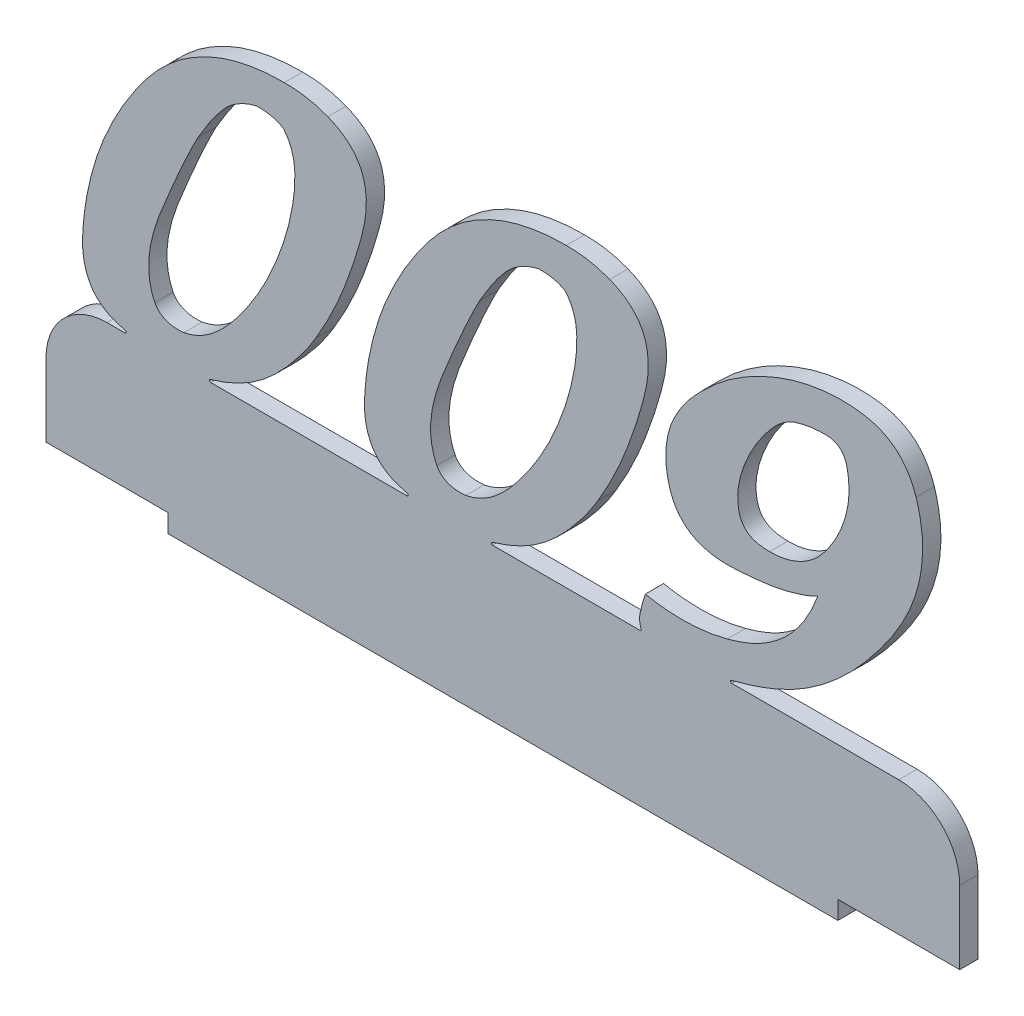
from build123d import *

# Parameters (mm, degrees)
BOSS_EXTRUDE1_DEPTH = 3
FILLET1_R           = 10
FILLET2_R           = 0.2


with BuildPart() as part:
    # Sketch1 → Boss-Extrude1 (new body)
    with BuildSketch(Plane.XY):
        with BuildLine():
            Line((122.108523146, 21.999999993), (150, 21.999999993))
            Line((150, 21.999999993), (150, 0))
            Line((150, 0), (130, 0))
            Line((130, 0), (130, -3))
            Line((130, -3), (20, -3))
            Line((20, -3), (20, 0))
            Line((20, 0), (0, 0))
            Line((0, 0), (0, 21.999999993))
            Line((0, 21.999999993), (14.850734766, 21.999999993))
            add(Edge.make_bspline(
                [(14.850734766, 21.999999993), (13.833222144, 22.185746321), (12.294676232, 22.547490024), (10.31460573, 23.244901476), (9.008220383, 24.094759696), (7.898257387, 25.113820238), (7.06838398, 26.391091086), (6.462901727, 27.862621286), (5.90927732, 30.227463468), (5.978909551, 32.147170043), (6.069251818, 33.461703309)],
                knots=[0.385713636, 0.385713636, 0.385713636, 0.385713636, 0.501387928, 0.562299825, 0.61931963, 0.674487907, 0.729675441, 0.788153341, 0.851799168, 1, 1, 1, 1], degree=3))
            add(Edge.make_bspline(
                [(6.069251818, 33.461703309), (6.236175884, 35.689799717), (6.725368754, 39.015373342), (7.854755227, 43.352177461), (8.917587622, 46.561540842), (10.272211064, 49.694878359), (11.810209289, 52.800707584), (13.617945818, 55.843856526), (15.625030894, 58.810990548), (17.82256933, 61.600339244), (20.296824136, 64.019153046), (22.93908857, 66.106784733), (25.819308824, 67.754175527), (28.85480882, 69.102017217), (33.277216497, 70.324345952), (36.755935353, 70.709060232), (39.122418354, 70.678278759)],
                knots=[0, 0, 0, 0, 0.122246067, 0.183381441, 0.245050885, 0.307031795, 0.37001055, 0.434578783, 0.500534692, 0.565957523, 0.628479512, 0.689453544, 0.749684058, 0.80955899, 0.870724503, 1, 1, 1, 1], degree=3))
            add(Edge.make_bspline(
                [(39.122418354, 70.678278759), (40.382657809, 70.667828905), (42.825497091, 70.524312973), (45.165651014, 69.814457179), (46.256898417, 69.407754912)],
                knots=[0, 0, 0, 0, 0.519885394, 1, 1, 1, 1], degree=3))
            add(Edge.make_bspline(
                [(46.256898417, 69.407754912), (47.52444583, 68.892456699), (49.319498488, 67.899106728), (51.058811155, 65.916194709), (51.968333247, 64.242720588), (52.483615829, 62.337801774), (52.648926803, 60.220756413), (52.455819366, 57.889987868), (51.706419101, 54.550580326), (50.427898754, 50.384152241), (48.126715144, 44.080572726), (45.929798961, 39.654295336), (44.263153303, 36.901890956)],
                knots=[0, 0, 0, 0, 0.111905612, 0.162582178, 0.212592743, 0.265416324, 0.321765959, 0.384451445, 0.45478123, 0.599580751, 0.738515281, 1, 1, 1, 1], degree=3))
            add(Edge.make_bspline(
                [(44.263153303, 36.901890956), (43.171669185, 35.044678672), (41.301371752, 32.474204186), (38.552020372, 29.351221076), (36.383325475, 27.281953243), (34.000893798, 25.474290787), (31.321170001, 23.978496673), (28.47055622, 22.819698003), (26.487014209, 22.240484451), (25.518502149, 21.999999993)],
                knots=[0, 0, 0, 0, 0.257859597, 0.380113614, 0.498337489, 0.61657684, 0.737567111, 0.865047578, 0.984702487, 0.984702487, 0.984702487, 0.984702487], degree=3))
            Line((25.518502149, 21.999999993), (61.136895862, 21.999999993))
            add(Edge.make_bspline(
                [(61.136895862, 21.999999993), (60.11938323, 22.185746322), (58.580837306, 22.547490018), (56.600766794, 23.244901476), (55.294381447, 24.094759696), (54.18441845, 25.113820238), (53.354545044, 26.391091086), (52.749062791, 27.862621286), (52.195438383, 30.227463468), (52.265070614, 32.147170043), (52.355412881, 33.461703309)],
                knots=[0.385713634, 0.385713634, 0.385713634, 0.385713634, 0.501387928, 0.562299825, 0.61931963, 0.674487907, 0.729675441, 0.788153341, 0.851799168, 1, 1, 1, 1], degree=3))
            add(Edge.make_bspline(
                [(52.355412881, 33.461703309), (52.522336947, 35.689799717), (53.011529817, 39.015373342), (54.14091629, 43.352177461), (55.203748685, 46.561540842), (56.558372128, 49.694878359), (58.096370352, 52.800707584), (59.904106881, 55.843856526), (61.911191957, 58.810990548), (64.108730393, 61.600339244), (66.582985199, 64.019153046), (69.225249633, 66.106784733), (72.105469888, 67.754175527), (75.140969883, 69.102017217), (79.56337756, 70.324345952), (83.042096416, 70.709060232), (85.408579417, 70.678278759)],
                knots=[0, 0, 0, 0, 0.122246067, 0.183381441, 0.245050885, 0.307031795, 0.37001055, 0.434578783, 0.500534692, 0.565957523, 0.628479512, 0.689453544, 0.749684058, 0.80955899, 0.870724503, 1, 1, 1, 1], degree=3))
            add(Edge.make_bspline(
                [(85.408579417, 70.678278759), (86.668818873, 70.667828905), (89.111658154, 70.524312973), (91.451812078, 69.814457179), (92.54305948, 69.407754912)],
                knots=[0, 0, 0, 0, 0.519885394, 1, 1, 1, 1], degree=3))
            add(Edge.make_bspline(
                [(92.54305948, 69.407754912), (93.810606894, 68.892456699), (95.605659552, 67.899106728), (97.344972218, 65.916194709), (98.25449431, 64.242720588), (98.769776892, 62.337801774), (98.935087867, 60.220756413), (98.741980429, 57.889987868), (97.992580164, 54.550580326), (96.714059817, 50.384152241), (94.412876207, 44.080572726), (92.215960024, 39.654295336), (90.549314367, 36.901890956)],
                knots=[0, 0, 0, 0, 0.111905612, 0.162582178, 0.212592743, 0.265416324, 0.321765959, 0.384451445, 0.45478123, 0.599580751, 0.738515281, 1, 1, 1, 1], degree=3))
            add(Edge.make_bspline(
                [(90.549314367, 36.901890956), (89.457830248, 35.044678672), (87.587532815, 32.474204186), (84.838181436, 29.351221076), (82.669486539, 27.281953243), (80.287054861, 25.474290787), (77.607331065, 23.978496673), (74.756717283, 22.819698003), (72.773175272, 22.240484451), (71.804663212, 21.999999993)],
                knots=[0, 0, 0, 0, 0.257859597, 0.380113614, 0.498337489, 0.61657684, 0.737567111, 0.865047578, 0.984702487, 0.984702487, 0.984702487, 0.984702487], degree=3))
            Line((71.804663212, 21.999999993), (97.849523776, 21.999999993))
            add(Edge.make_bspline(
                [(97.849523776, 21.999999993), (97.741729911, 22.17037449), (97.664247908, 22.378826061)],
                knots=[0.784122226, 0.784122226, 0.784122226, 1, 1, 1], degree=2))
            add(Edge.make_bspline(
                [(97.664247908, 22.378826061), (97.267205614, 23.516537082), (97.586061826, 24.685315506)],
                knots=[0, 0, 0, 1, 1, 1], degree=2))
            add(Edge.make_bspline(
                [(97.586061826, 24.685315506), (97.894239409, 26.166815749), (98.387469175, 27.597747093)],
                knots=[0, 0, 0, 1, 1, 1], degree=2))
            add(Edge.make_bspline(
                [(98.387469175, 27.597747093), (100.640783959, 27.122975858), (105.176526884, 26.743762366), (109.687289001, 27.348641768), (111.83547543, 27.930037945)],
                knots=[0, 0, 0, 0, 0.508624118, 1, 1, 1, 1], degree=3))
            add(Edge.make_bspline(
                [(111.83547543, 27.930037945), (113.565118905, 28.395284355), (116.090164605, 29.258086785), (119.072135462, 31.072041163), (121.064016831, 32.633103531), (122.813221866, 34.484149525), (124.928046151, 37.296651786), (126.050143941, 39.750159491), (126.690831177, 41.436683762)],
                knots=[0, 0, 0, 0, 0.256975644, 0.377834121, 0.497938926, 0.61793154, 0.74116445, 1, 1, 1, 1], degree=3))
            add(Edge.make_bspline(
                [(126.690831177, 41.436683762), (125.81258914, 40.981250394), (124.385479324, 40.412368951), (122.362562183, 39.812818101), (120.675281062, 39.396521396), (118.859881508, 39.070245241), (116.915092314, 38.819682408), (114.847955743, 38.632183089), (112.711512719, 38.476523432), (110.619580539, 38.490039817), (108.686756693, 38.77615805), (106.98850184, 39.322822655), (105.4950821, 40.104954368), (104.268168309, 41.188376081), (102.881256722, 43.01226951), (102.328903257, 44.70760396), (102.081761591, 45.873743966)],
                knots=[0, 0, 0, 0, 0.103258829, 0.16012673, 0.220401961, 0.284772054, 0.352756809, 0.425249443, 0.501655636, 0.576563673, 0.64339303, 0.704973162, 0.762247209, 0.818227778, 0.874604441, 1, 1, 1, 1], degree=3))
            add(Edge.make_bspline(
                [(102.081761591, 45.873743966), (101.835798059, 47.027692102), (101.657865686, 48.7895967), (101.871322815, 51.122118823), (102.241651396, 52.823688913), (102.83660557, 54.494022148), (103.675710642, 56.112813827), (104.688185299, 57.72680655), (106.347027841, 59.793737367), (108.690254981, 62.19876305), (111.777789646, 64.769761112), (115.135006417, 66.963068458), (118.707932332, 68.739159826), (122.391682572, 70.117254948), (126.104849285, 70.979771837), (129.783087091, 71.373229588), (132.800147143, 71.250530978), (135.105256086, 70.876914209), (136.690542599, 70.414977286), (138.112319083, 69.735238374), (139.401322411, 68.901409533), (140.512405432, 67.84187118), (141.791237885, 66.135600319), (142.508785189, 64.663052563), (142.836257291, 63.602438258)],
                knots=[0, 0, 0, 0, 0.060653393, 0.09024413, 0.120065148, 0.149935014, 0.181085816, 0.213601707, 0.247701702, 0.317092476, 0.385823978, 0.453813994, 0.522704394, 0.590511906, 0.65549625, 0.718107584, 0.780117806, 0.810012065, 0.837981849, 0.864646169, 0.890745133, 0.916565464, 0.943088518, 1, 1, 1, 1], degree=3))
            add(Edge.make_bspline(
                [(142.836257291, 63.602438258), (143.402055594, 61.791956398), (143.979071897, 58.980425444), (143.90680065, 55.177429489), (143.514731151, 52.314597179), (142.739542621, 49.429174822), (141.597056174, 46.525972675), (140.066616541, 43.615263955), (138.213151291, 40.741019533), (136.144045986, 37.985270444), (134.019105683, 35.382585519), (131.805946071, 33.037310097), (129.537482789, 30.917208081), (127.207145906, 29.033075616), (124.05846007, 26.859505391), (121.548789773, 25.538245589), (119.830002404, 24.822141151)],
                knots=[0, 0, 0, 0, 0.116714591, 0.174354424, 0.232938387, 0.293808786, 0.357430265, 0.424202874, 0.495481207, 0.56728462, 0.635800178, 0.701771496, 0.765206379, 0.826400926, 0.885684809, 1, 1, 1, 1], degree=3))
            add(Edge.make_bspline(
                [(119.830002404, 24.822141151), (116.928622762, 23.612174232), (113.918845817, 22.660654846), (110.845146061, 21.999999993)],
                knots=[0, 0, 0, 0, 0.501798791, 0.501798791, 0.501798791, 0.501798791], degree=3))
            Line((110.845146061, 21.999999993), (122.108523146, 21.999999993))
        make_face()
        with BuildLine():
            add(Edge.make_bspline(
                [(38.985592709, 64.071554755), (38.384332743, 64.481071905), (36.919044437, 64.987216101), (35.381248397, 65.114511236), (34.568079026, 65.068427312)],
                knots=[0, 0, 0, 0, 0.469698931, 1, 1, 1, 1], degree=3))
            add(Edge.make_bspline(
                [(34.568079026, 65.068427312), (33.423377755, 64.82773881), (31.805338847, 64.150210504), (29.916951903, 62.772644756), (27.609045225, 60.194584481), (26.075347462, 57.743000433), (24.931644312, 55.76428345)],
                knots=[0, 0, 0, 0, 0.252589616, 0.375811021, 0.503770371, 1, 1, 1, 1], degree=3))
            add(Edge.make_bspline(
                [(24.931644312, 55.76428345), (24.475365496, 54.966227696), (23.877145682, 53.64966207), (22.985632521, 51.83059971), (22.27216486, 50.249051761), (21.507783336, 48.529823277), (20.707296032, 46.663094433), (19.850697233, 44.666886331), (18.978633216, 42.578564623), (18.185644724, 40.480388628), (17.553989016, 38.453035442), (17.113183476, 36.545941738), (16.870281991, 34.752897894), (16.822968163, 33.073613364), (17.024672334, 31.047914158), (17.44418034, 29.624256806), (17.875350332, 28.770538336)],
                knots=[0, 0, 0, 0, 0.095871325, 0.150956838, 0.211549603, 0.277044413, 0.347448488, 0.423659813, 0.503898773, 0.583776288, 0.6578152, 0.725493304, 0.78794858, 0.846481479, 0.900510454, 1, 1, 1, 1], degree=3))
            add(Edge.make_bspline(
                [(17.875350332, 28.770538336), (18.233797174, 28.027521318), (19.73327123, 26.820245836), (21.646172276, 26.803657585), (22.625154867, 26.874525827)],
                knots=[0, 0, 0, 0, 0.446153942, 1, 1, 1, 1], degree=3))
            add(Edge.make_bspline(
                [(22.625154867, 26.874525827), (24.082679365, 27.148881035), (26.239274633, 28.1673016), (28.771576151, 30.335071132), (30.7220381, 32.49226371), (32.588837139, 34.977782882), (34.350362905, 37.651784678), (35.940811043, 40.478271276), (37.335338962, 43.434519277), (38.53348913, 46.451503736), (39.525024109, 49.463565585), (40.243705998, 52.452062439), (40.748243207, 55.342665787), (40.917860026, 58.044421043), (40.715993892, 61.074984208), (39.84114728, 63.063535672), (38.985592709, 64.071554755)],
                knots=[0, 0, 0, 0, 0.099522769, 0.157975555, 0.224341199, 0.295661745, 0.367825167, 0.440561069, 0.514605516, 0.588508481, 0.659789613, 0.728660389, 0.796041852, 0.857776262, 0.9112652, 1, 1, 1, 1], degree=3))
        make_face(mode=Mode.SUBTRACT)
        with BuildLine():
            add(Edge.make_bspline(
                [(85.271753772, 64.071554755), (84.670493806, 64.481071905), (83.2052055, 64.987216101), (81.66740946, 65.114511236), (80.85424009, 65.068427312)],
                knots=[0, 0, 0, 0, 0.469698931, 1, 1, 1, 1], degree=3))
            add(Edge.make_bspline(
                [(80.85424009, 65.068427312), (79.709538818, 64.82773881), (78.09149991, 64.150210504), (76.203112966, 62.772644756), (73.895206288, 60.194584481), (72.361508525, 57.743000433), (71.217805375, 55.76428345)],
                knots=[0, 0, 0, 0, 0.252589616, 0.375811021, 0.503770371, 1, 1, 1, 1], degree=3))
            add(Edge.make_bspline(
                [(71.217805375, 55.76428345), (70.76152656, 54.966227696), (70.163306746, 53.64966207), (69.271793584, 51.83059971), (68.558325923, 50.249051761), (67.793944399, 48.529823277), (66.993457095, 46.663094433), (66.136858296, 44.666886331), (65.264794279, 42.578564623), (64.471805787, 40.480388628), (63.840150079, 38.453035442), (63.399344539, 36.545941738), (63.156443054, 34.752897894), (63.109129226, 33.073613364), (63.310833397, 31.047914158), (63.730341403, 29.624256806), (64.161511396, 28.770538336)],
                knots=[0, 0, 0, 0, 0.095871325, 0.150956838, 0.211549603, 0.277044413, 0.347448488, 0.423659813, 0.503898773, 0.583776288, 0.6578152, 0.725493304, 0.78794858, 0.846481479, 0.900510454, 1, 1, 1, 1], degree=3))
            add(Edge.make_bspline(
                [(64.161511396, 28.770538336), (64.519958237, 28.027521318), (66.019432293, 26.820245836), (67.93233334, 26.803657585), (68.91131593, 26.874525827)],
                knots=[0, 0, 0, 0, 0.446153942, 1, 1, 1, 1], degree=3))
            add(Edge.make_bspline(
                [(68.91131593, 26.874525827), (70.368840428, 27.148881035), (72.525435697, 28.1673016), (75.057737214, 30.335071132), (77.008199164, 32.49226371), (78.874998202, 34.977782882), (80.636523969, 37.651784678), (82.226972106, 40.478271276), (83.621500025, 43.434519277), (84.819650193, 46.451503736), (85.811185172, 49.463565585), (86.529867062, 52.452062439), (87.03440427, 55.342665787), (87.20402109, 58.044421043), (87.002154955, 61.074984208), (86.127308344, 63.063535672), (85.271753772, 64.071554755)],
                knots=[0, 0, 0, 0, 0.099522769, 0.157975555, 0.224341199, 0.295661745, 0.367825167, 0.440561069, 0.514605516, 0.588508481, 0.659789613, 0.728660389, 0.796041852, 0.857776262, 0.9112652, 1, 1, 1, 1], degree=3))
        make_face(mode=Mode.SUBTRACT)
        with BuildLine():
            add(Edge.make_bspline(
                [(131.499275274, 62.155995725), (131.347153696, 62.987421289), (130.735298833, 64.219582516), (129.146595833, 64.99346658), (126.521463907, 65.147996799), (124.328941632, 64.758739809), (122.664247908, 64.2083804)],
                knots=[0, 0, 0, 0, 0.248410702, 0.362075284, 0.49472071, 1, 1, 1, 1], degree=3))
            add(Edge.make_bspline(
                [(122.664247908, 64.2083804), (121.80336148, 63.844408785), (120.539584885, 63.002927834), (119.054837596, 61.450403675), (117.87794462, 59.980450003), (116.766387959, 58.343343292), (115.766108463, 56.638187042), (114.948622825, 54.877970224), (114.252927815, 53.125008172), (113.790656021, 51.386895733), (113.532053089, 49.720203058), (113.554943254, 48.142595348), (113.794187083, 46.678862308), (114.390217484, 45.370678075), (115.979136036, 43.991736584), (117.68302824, 43.848993899), (118.774490285, 43.82135929)],
                knots=[0, 0, 0, 0, 0.103918203, 0.167102988, 0.238919116, 0.313673302, 0.387561196, 0.459053263, 0.529881584, 0.597547164, 0.659188819, 0.717309669, 0.772734814, 0.823742016, 0.874176962, 1, 1, 1, 1], degree=3))
            add(Edge.make_bspline(
                [(118.774490285, 43.82135929), (119.705487396, 43.823587146), (121.089309671, 43.957852936), (122.825418141, 44.504189705), (124.05735603, 45.026091501), (125.202114893, 45.740983872), (126.692686206, 46.886974138), (127.606079977, 48.001703705), (128.195913272, 48.766629032)],
                knots=[0, 0, 0, 0, 0.252638462, 0.372665341, 0.492015566, 0.613998834, 0.737214351, 1, 1, 1, 1], degree=3))
            add(Edge.make_bspline(
                [(128.195913272, 48.766629032), (128.934276793, 49.828721781), (129.932363433, 51.450620769), (130.8774479, 53.748276989), (131.380314987, 55.425200141), (131.735803673, 57.10430951), (131.871895875, 59.360034441), (131.741314136, 61.051473049), (131.499275274, 62.155995725)],
                knots=[0, 0, 0, 0, 0.273616322, 0.400152776, 0.523826625, 0.643149278, 0.761819063, 1, 1, 1, 1], degree=3))
        make_face(mode=Mode.SUBTRACT)
    extrude(amount=BOSS_EXTRUDE1_DEPTH)

    # Fillet1
    fillet1_edges = [part.edges().sort_by_distance(p)[0] for p in [
        (150, 21.999999993, 1.5),
        (0, 21.999999993, 1.5),
    ]]
    fillet(fillet1_edges, radius=FILLET1_R)

    # Fillet2
    fillet2_edges = [part.edges().sort_by_distance(p)[0] for p in [
        (25.518502149, 21.999999993, 1.5),
        (71.804663212, 21.999999993, 1.5),
        (110.845146061, 21.999999993, 1.5),
        (97.849523776, 21.999999993, 1.5),
        (61.136895862, 21.999999993, 1.5),
        (14.850734766, 21.999999993, 1.5),
    ]]
    fillet(fillet2_edges, radius=FILLET2_R)


solid = part.part
